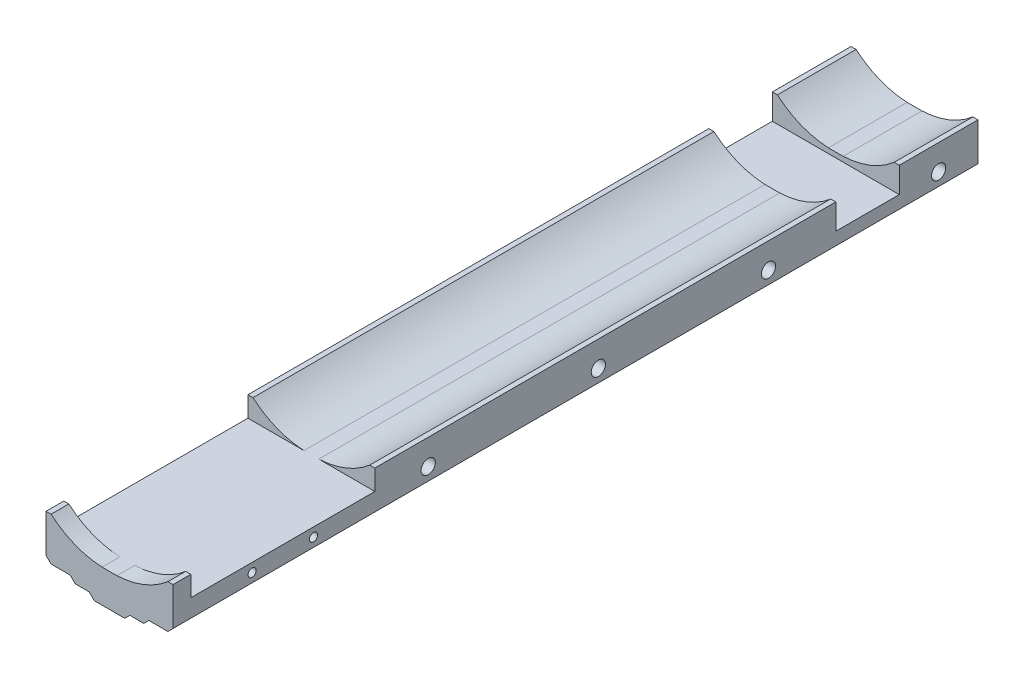
from build123d import *

# Parameters (mm, degrees)
SKETCH1_W               = 50
SKETCH1_H               = 317
BOSS_EXTRUDE1_DEPTH     = 7
BOSS_EXTRUDE2_DEPTH     = 317
SKETCH4_W               = 50
SKETCH4_H               = 72.5
CUT_EXTRUDE2_DEPTH      = 15
CUT_EXTRUDE3_DEPTH      = 12.5
CUT_EXTRUDE3_DEPTH_BACK = 2
SKETCH5_W               = 50
SKETCH5_H               = 25
SKETCH6_R               = 1.6
CUT_EXTRUDE4_DEPTH      = 4.5
SKETCH7_R               = 2.8
CUT_EXTRUDE5_DEPTH      = 9.1
LPATTERN2_COUNT         = 4
LPATTERN2_PITCH         = 67
MIRROR3_COPY_1_SKETCH_R = 2.8
MIRROR3_COPY_1_DEPTH    = 9.1
MIRROR3_COPY_2_SKETCH_R = 2.8
MIRROR3_COPY_2_DEPTH    = 9.1
MIRROR3_COPY_3_SKETCH_R = 2.8
MIRROR3_COPY_3_DEPTH    = 9.1
BOSS_EXTRUDE3_DEPTH     = 317


with BuildPart() as part:
    # Sketch1 → Boss-Extrude1 (new body)
    with BuildSketch(Plane(origin=(0, 0, 0), x_dir=(1, 0, 0), z_dir=(0, 1, 0))):
        Rectangle(SKETCH1_W, SKETCH1_H)
    extrude(amount=BOSS_EXTRUDE1_DEPTH)

    # Sketch2 → Boss-Extrude2 (add)
    with BuildSketch(Plane.XY.offset(158.5)):
        with BuildLine():
            Line((25, 0), (25, 15))
            Line((25, 15), (23, 15))
            ThreePointArc((23, 15), (12.243394569, 8.789970948), (-0.047456713, 7))
            Line((-0.047456713, 7), (-0.047456713, 0))
            Line((-0.047456713, 0), (25, 0))
        make_face()
    boss_extrude2 = extrude(amount=-BOSS_EXTRUDE2_DEPTH)

    # Mirror1: Boss-Extrude2 across plane
    add(boss_extrude2.mirror(Plane(origin=(0, 0, 0), x_dir=(0, 0, 1), z_dir=(1, 0, 0))))

    # Sketch4 → Cut-Extrude2 (cut)
    with BuildSketch(Plane(origin=(0, 7, 0), x_dir=(1, 0, 0), z_dir=(0, 1, 0))):
        with Locations((0, -115.25)):
            Rectangle(SKETCH4_W, SKETCH4_H)
    extrude(amount=CUT_EXTRUDE2_DEPTH, mode=Mode.SUBTRACT)

    # Sketch5 → Cut-Extrude3 (cut, two sides: drawn at the far end of the back side and taken through both)
    with BuildSketch(Plane(origin=(0, 7, 0), x_dir=(1, 0, 0), z_dir=(0, 1, 0)).offset(-CUT_EXTRUDE3_DEPTH_BACK)):
        with Locations((0, 115)):
            Rectangle(SKETCH5_W, SKETCH5_H)
    extrude(amount=CUT_EXTRUDE3_DEPTH + CUT_EXTRUDE3_DEPTH_BACK, mode=Mode.SUBTRACT)

    # Sketch6 → Cut-Extrude4 (cut)
    with BuildSketch(Plane.ZY.offset(25)):
        with Locations((103.166666667, 3.5)):
            Circle(SKETCH6_R)
        with Locations((127.333333333, 3.5)):
            Circle(SKETCH6_R)
    cut_extrude4 = extrude(amount=-CUT_EXTRUDE4_DEPTH, mode=Mode.SUBTRACT)

    # Sketch7 → Cut-Extrude5 (cut)
    with BuildSketch(Plane(origin=(25, 0, 0), x_dir=(0, 0, -1), z_dir=(1, 0, 0))):
        with Locations((143, 5)):
            Circle(SKETCH7_R)
    cut_extrude5 = extrude(amount=-CUT_EXTRUDE5_DEPTH, mode=Mode.SUBTRACT)

    # LPattern2: Cut-Extrude5 ×4
    with Locations(*[(0, 0, i * LPATTERN2_PITCH) for i in range(1, LPATTERN2_COUNT)]):
        add(cut_extrude5, mode=Mode.SUBTRACT)

    # Mirror3: Cut-Extrude4, Cut-Extrude5 across plane
    add(cut_extrude4.mirror(Plane(origin=(0, 0, 0), x_dir=(0, 0, 1), z_dir=(1, 0, 0))), mode=Mode.SUBTRACT)
    add(cut_extrude5.mirror(Plane(origin=(0, 0, 0), x_dir=(0, 0, 1), z_dir=(1, 0, 0))), mode=Mode.SUBTRACT)

    # Mirror3 copy 1 sketch → Mirror3 copy 1 (cut)
    with BuildSketch(Plane(origin=(-25, 0, 67), x_dir=(0, 0, -1), z_dir=(-1, 0, 0))):
        with Locations((143, -5)):
            Circle(MIRROR3_COPY_1_SKETCH_R)
    extrude(amount=-MIRROR3_COPY_1_DEPTH, mode=Mode.SUBTRACT)

    # Mirror3 copy 2 sketch → Mirror3 copy 2 (cut)
    with BuildSketch(Plane(origin=(-25, 0, 134), x_dir=(0, 0, -1), z_dir=(-1, 0, 0))):
        with Locations((143, -5)):
            Circle(MIRROR3_COPY_2_SKETCH_R)
    extrude(amount=-MIRROR3_COPY_2_DEPTH, mode=Mode.SUBTRACT)

    # Mirror3 copy 3 sketch → Mirror3 copy 3 (cut)
    with BuildSketch(Plane(origin=(-25, 0, 201), x_dir=(0, 0, -1), z_dir=(-1, 0, 0))):
        with Locations((143, -5)):
            Circle(MIRROR3_COPY_3_SKETCH_R)
    extrude(amount=-MIRROR3_COPY_3_DEPTH, mode=Mode.SUBTRACT)

    # Sketch8 → Boss-Extrude3 (add)
    with BuildSketch(Plane.XY.offset(158.5)):
        Polygon((23, -2), (15.5, -2), (13.5, -4), (8, -4), (6, -6), (0, -6), (0, 0), (25, 0), align=None)
    boss_extrude3 = extrude(amount=-BOSS_EXTRUDE3_DEPTH)

    # Mirror4: Boss-Extrude3 across plane
    add(boss_extrude3.mirror(Plane(origin=(0, 0, 0), x_dir=(0, 0, 1), z_dir=(1, 0, 0))))


solid = part.part
